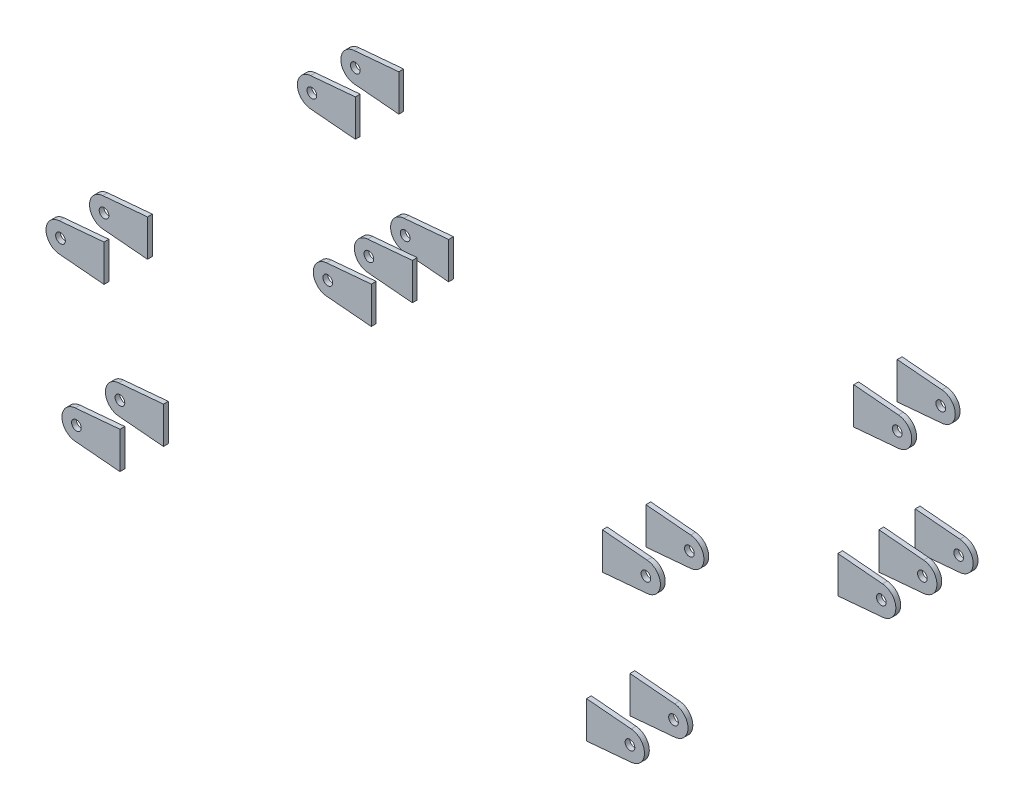
from build123d import *

# Parameters (mm, degrees)
BOSS_EXTRUDE1_START = 20
SKETCH1_R           = 5
BOSS_EXTRUDE1_DEPTH = 5
BOSS_EXTRUDE2_START = -20
SKETCH1_3_R         = 5
BOSS_EXTRUDE2_DEPTH = 5
BOSS_EXTRUDE3_START = -20
SKETCH2_R           = 5
BOSS_EXTRUDE3_DEPTH = 5
BOSS_EXTRUDE4_START = 20
SKETCH2_4_R         = 5
BOSS_EXTRUDE4_DEPTH = 5
BOSS_EXTRUDE5_START = 20
SKETCH3_R           = 5
BOSS_EXTRUDE5_DEPTH = 5
BOSS_EXTRUDE6_START = -20
SKETCH3_3_R         = 5
BOSS_EXTRUDE6_DEPTH = 5
BOSS_EXTRUDE7_START = 20
SKETCH4_R           = 5
BOSS_EXTRUDE7_DEPTH = 5
BOSS_EXTRUDE8_START = -20
SKETCH4_3_R         = 5
BOSS_EXTRUDE8_DEPTH = 2.5
BOSS_EXTRUDE9_START = -15
SKETCH5_R           = 5
BOSS_EXTRUDE9_DEPTH = 5


with BuildPart() as part:
    # Sketch1 → Boss-Extrude1 (new body)
    with BuildSketch(Plane.XY.offset(-1495).offset(BOSS_EXTRUDE1_START)):
        with BuildLine():
            Line((257.769498028, 323.055200897), (304.078663494, 327.112440584))
            ThreePointArc((304.078663494, 327.112440584), (317.769498028, 342.055200897), (304.078663494, 356.99796121))
            Line((304.078663494, 356.99796121), (257.769498028, 361.055200897))
            Line((257.769498028, 361.055200897), (257.769498028, 323.055200897))
        make_face()
        with Locations((302.769498028, 342.055200897)):
            Circle(SKETCH1_R, mode=Mode.SUBTRACT)
    extrude(amount=BOSS_EXTRUDE1_DEPTH)


with BuildPart() as body_2:
    # Sketch1<3> → Boss-Extrude2 (new body)
    with BuildSketch(Plane.XY.offset(-1495).offset(BOSS_EXTRUDE2_START)):
        with BuildLine():
            Line((257.769498028, 323.055200897), (304.078663494, 327.112440584))
            ThreePointArc((304.078663494, 327.112440584), (317.769498028, 342.055200897), (304.078663494, 356.99796121))
            Line((304.078663494, 356.99796121), (257.769498028, 361.055200897))
            Line((257.769498028, 361.055200897), (257.769498028, 323.055200897))
        make_face()
        with Locations((302.769498028, 342.055200897)):
            Circle(SKETCH1_3_R, mode=Mode.SUBTRACT)
    extrude(amount=-BOSS_EXTRUDE2_DEPTH)


with BuildPart() as body_3:
    # Sketch2 → Boss-Extrude3 (new body)
    with BuildSketch(Plane.XY.offset(-1755).offset(BOSS_EXTRUDE3_START)):
        with BuildLine():
            Line((257.769498028, 323.055200897), (304.078663494, 327.112440584))
            ThreePointArc((304.078663494, 327.112440584), (317.769498028, 342.055200897), (304.078663494, 356.99796121))
            Line((304.078663494, 356.99796121), (257.769498028, 361.055200897))
            Line((257.769498028, 361.055200897), (257.769498028, 323.055200897))
        make_face()
        with Locations((302.769498028, 342.055200897)):
            Circle(SKETCH2_R, mode=Mode.SUBTRACT)
    extrude(amount=-BOSS_EXTRUDE3_DEPTH)


with BuildPart() as body_4:
    # Sketch2<4> → Boss-Extrude4 (new body)
    with BuildSketch(Plane.XY.offset(-1755).offset(BOSS_EXTRUDE4_START)):
        with BuildLine():
            Line((257.769498028, 323.055200897), (304.078663494, 327.112440584))
            ThreePointArc((304.078663494, 327.112440584), (317.769498028, 342.055200897), (304.078663494, 356.99796121))
            Line((304.078663494, 356.99796121), (257.769498028, 361.055200897))
            Line((257.769498028, 361.055200897), (257.769498028, 323.055200897))
        make_face()
        with Locations((302.769498028, 342.055200897)):
            Circle(SKETCH2_4_R, mode=Mode.SUBTRACT)
    extrude(amount=BOSS_EXTRUDE4_DEPTH)


with BuildPart() as body_5:
    # Sketch3 → Boss-Extrude5 (new body)
    with BuildSketch(Plane.XY.offset(-1495).offset(BOSS_EXTRUDE5_START)):
        with BuildLine():
            Line((241.3, 201.577968064), (241.3, 163.577968064))
            Line((241.3, 163.577968064), (287.609165466, 167.635207751))
            ThreePointArc((287.609165466, 167.635207751), (301.3, 182.577968064), (287.609165466, 197.520728378))
            Line((287.609165466, 197.520728378), (241.3, 201.577968064))
        make_face()
        with Locations((286.3, 182.577968064)):
            Circle(SKETCH3_R, mode=Mode.SUBTRACT)
    extrude(amount=BOSS_EXTRUDE5_DEPTH)


with BuildPart() as body_6:
    # Sketch3<3> → Boss-Extrude6 (new body)
    with BuildSketch(Plane.XY.offset(-1495).offset(BOSS_EXTRUDE6_START)):
        with BuildLine():
            Line((241.3, 201.577968064), (241.3, 163.577968064))
            Line((241.3, 163.577968064), (287.609165466, 167.635207751))
            ThreePointArc((287.609165466, 167.635207751), (301.3, 182.577968064), (287.609165466, 197.520728378))
            Line((287.609165466, 197.520728378), (241.3, 201.577968064))
        make_face()
        with Locations((286.3, 182.577968064)):
            Circle(SKETCH3_3_R, mode=Mode.SUBTRACT)
    extrude(amount=-BOSS_EXTRUDE6_DEPTH)


with BuildPart() as body_7:
    # Sketch4 → Boss-Extrude7 (new body)
    with BuildSketch(Plane.XY.offset(-1755).offset(BOSS_EXTRUDE7_START)):
        with BuildLine():
            Line((241.3, 163.577968064), (287.609165466, 167.635207751))
            ThreePointArc((287.609165466, 167.635207751), (301.3, 182.577968064), (287.609165466, 197.520728378))
            Line((287.609165466, 197.520728378), (241.3, 201.577968064))
            Line((241.3, 201.577968064), (241.3, 163.577968064))
        make_face()
        with Locations((286.3, 182.577968064)):
            Circle(SKETCH4_R, mode=Mode.SUBTRACT)
    extrude(amount=BOSS_EXTRUDE7_DEPTH)


with BuildPart() as body_8:
    # Sketch4<3> → Boss-Extrude8 (new, symmetric)
    with BuildSketch(Plane.XY.offset(-1755).offset(BOSS_EXTRUDE8_START)):
        with BuildLine():
            Line((241.3, 163.577968064), (287.609165466, 167.635207751))
            ThreePointArc((287.609165466, 167.635207751), (301.3, 182.577968064), (287.609165466, 197.520728378))
            Line((287.609165466, 197.520728378), (241.3, 201.577968064))
            Line((241.3, 201.577968064), (241.3, 163.577968064))
        make_face()
        with Locations((286.3, 182.577968064)):
            Circle(SKETCH4_3_R, mode=Mode.SUBTRACT)
    extrude(amount=BOSS_EXTRUDE8_DEPTH, both=True)


with BuildPart() as body_9:
    # Sketch5 → Boss-Extrude9 (new body)
    with BuildSketch(Plane.XY.offset(-1795).offset(BOSS_EXTRUDE9_START)):
        with BuildLine():
            Line((241.3, 163.577968064), (287.609165466, 167.635207751))
            ThreePointArc((287.609165466, 167.635207751), (301.3, 182.577968064), (287.609165466, 197.520728378))
            Line((287.609165466, 197.520728378), (241.3, 201.577968064))
            Line((241.3, 201.577968064), (241.3, 163.577968064))
        make_face()
        with Locations((286.3, 182.577968064)):
            Circle(SKETCH5_R, mode=Mode.SUBTRACT)
    extrude(amount=-BOSS_EXTRUDE9_DEPTH)


with BuildPart() as body_10:
    # Mirror1: mirrored copy
    add(part.part.mirror(Plane(origin=(0, 0, 0), x_dir=(0, 0, 1), z_dir=(1, 0, 0))))


with BuildPart() as body_11:
    # Mirror1 2: mirrored copy
    add(body_2.part.mirror(Plane(origin=(0, 0, 0), x_dir=(0, 0, 1), z_dir=(1, 0, 0))))


with BuildPart() as body_12:
    # Mirror1 3: mirrored copy
    add(body_4.part.mirror(Plane(origin=(0, 0, 0), x_dir=(0, 0, 1), z_dir=(1, 0, 0))))


with BuildPart() as body_13:
    # Mirror1 4: mirrored copy
    add(body_3.part.mirror(Plane(origin=(0, 0, 0), x_dir=(0, 0, 1), z_dir=(1, 0, 0))))


with BuildPart() as body_14:
    # Mirror1 5: mirrored copy
    add(body_5.part.mirror(Plane(origin=(0, 0, 0), x_dir=(0, 0, 1), z_dir=(1, 0, 0))))


with BuildPart() as body_15:
    # Mirror1 6: mirrored copy
    add(body_6.part.mirror(Plane(origin=(0, 0, 0), x_dir=(0, 0, 1), z_dir=(1, 0, 0))))


with BuildPart() as body_16:
    # Mirror1 7: mirrored copy
    add(body_7.part.mirror(Plane(origin=(0, 0, 0), x_dir=(0, 0, 1), z_dir=(1, 0, 0))))


with BuildPart() as body_17:
    # Mirror1 8: mirrored copy
    add(body_8.part.mirror(Plane(origin=(0, 0, 0), x_dir=(0, 0, 1), z_dir=(1, 0, 0))))


with BuildPart() as body_18:
    # Mirror1 9: mirrored copy
    add(body_9.part.mirror(Plane(origin=(0, 0, 0), x_dir=(0, 0, 1), z_dir=(1, 0, 0))))


solid = Compound([part.part, body_2.part, body_3.part, body_4.part, body_5.part, body_6.part, body_7.part, body_8.part, body_9.part, body_10.part, body_11.part, body_12.part, body_13.part, body_14.part, body_15.part, body_16.part, body_17.part, body_18.part])
